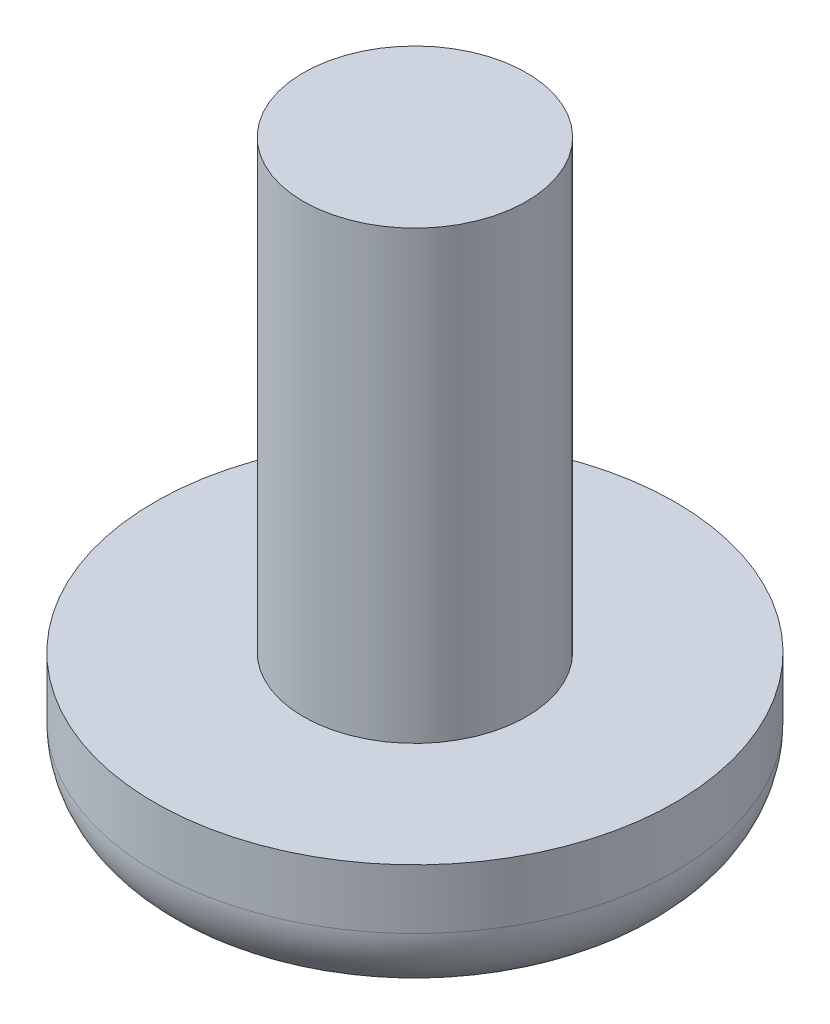
from build123d import *

# Parameters (mm, degrees)
SKETCH_1_R          = 1.5
EXTRUDE_1_DEPTH     = 6
SKETCH_2_R          = 3.5
EXTRUDE_2_DEPTH     = 1.8
CUT_EXTRUDE_1_DEPTH = 1
FILLET_1_R          = 1


with BuildPart() as part:
    # 草图1 → 凸台-拉伸1 (new body)
    with BuildSketch(Plane(origin=(0, 0, 0), x_dir=(1, 0, 0), z_dir=(0, 1, 0))):
        with Locations(Location((0, 0, 0), (0, 0, 270))):
            Circle(SKETCH_1_R)
    extrude(amount=EXTRUDE_1_DEPTH)

    # 草图2 → 凸台-拉伸2 (add)
    with BuildSketch(Plane.XZ):
        with Locations(Location((0, 0, 0), (0, 0, 270))):
            Circle(SKETCH_2_R)
    extrude(amount=EXTRUDE_2_DEPTH)

    # 草图3 → 切除-拉伸1 (cut)
    with BuildSketch(Plane.XZ.offset(1.8)):
        Polygon((1, 0.577350269), (0, 1.154700538), (-1, 0.577350269), (-1, -0.577350269), (0, -1.154700538), (1, -0.577350269), align=None)
    extrude(amount=-CUT_EXTRUDE_1_DEPTH, mode=Mode.SUBTRACT)

    # 圆角1
    fillet_1_edges = [part.edges().sort_by_distance(p)[0] for p in [
        (0, -1.8, 3.5),
    ]]
    fillet(fillet_1_edges, radius=FILLET_1_R)


solid = part.part
